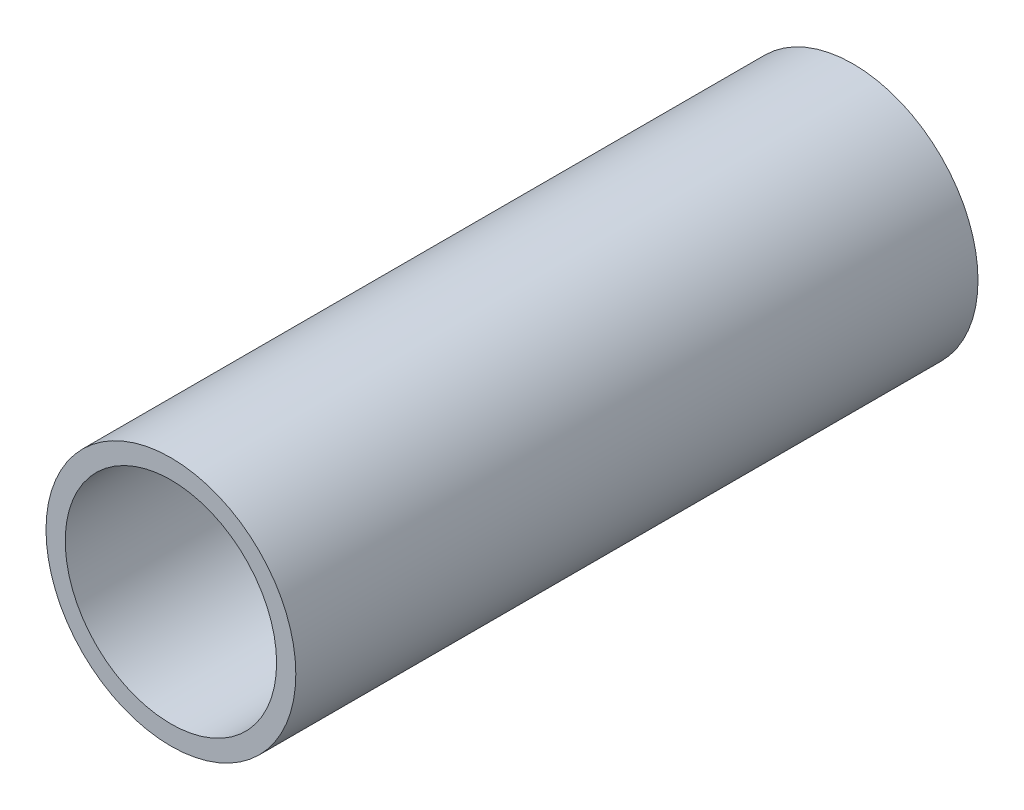
from build123d import *

# Parameters (mm, degrees)
BASE_SKETCH_R       = 13
BASE_SKETCH_R_2     = 11
BOSS_EXTRUDE1_DEPTH = 71


with BuildPart() as part:
    # base_sketch → Boss-Extrude1 (new body)
    with BuildSketch(Plane.XY):
        Circle(BASE_SKETCH_R)
        Circle(BASE_SKETCH_R_2, mode=Mode.SUBTRACT)
    extrude(amount=BOSS_EXTRUDE1_DEPTH)


solid = part.part
